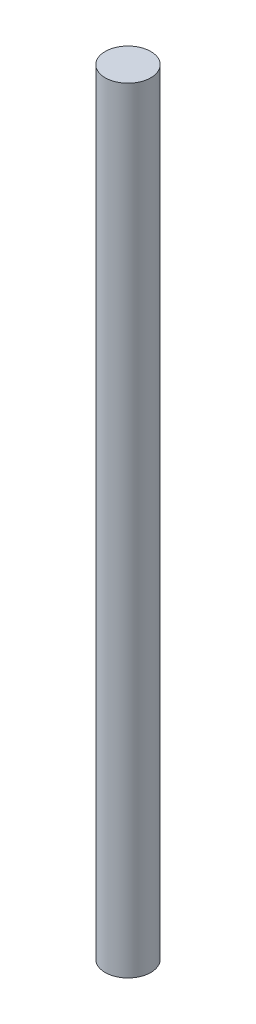
from build123d import *

# Parameters (mm, degrees)
SKETCH1_R           = 5
BOSS_EXTRUDE1_DEPTH = 170


with BuildPart() as part:
    # Sketch1 → Boss-Extrude1 (new body)
    with BuildSketch(Plane(origin=(0, 0, 0), x_dir=(1, 0, 0), z_dir=(0, 1, 0))):
        Circle(SKETCH1_R)
    extrude(amount=BOSS_EXTRUDE1_DEPTH)


solid = part.part
